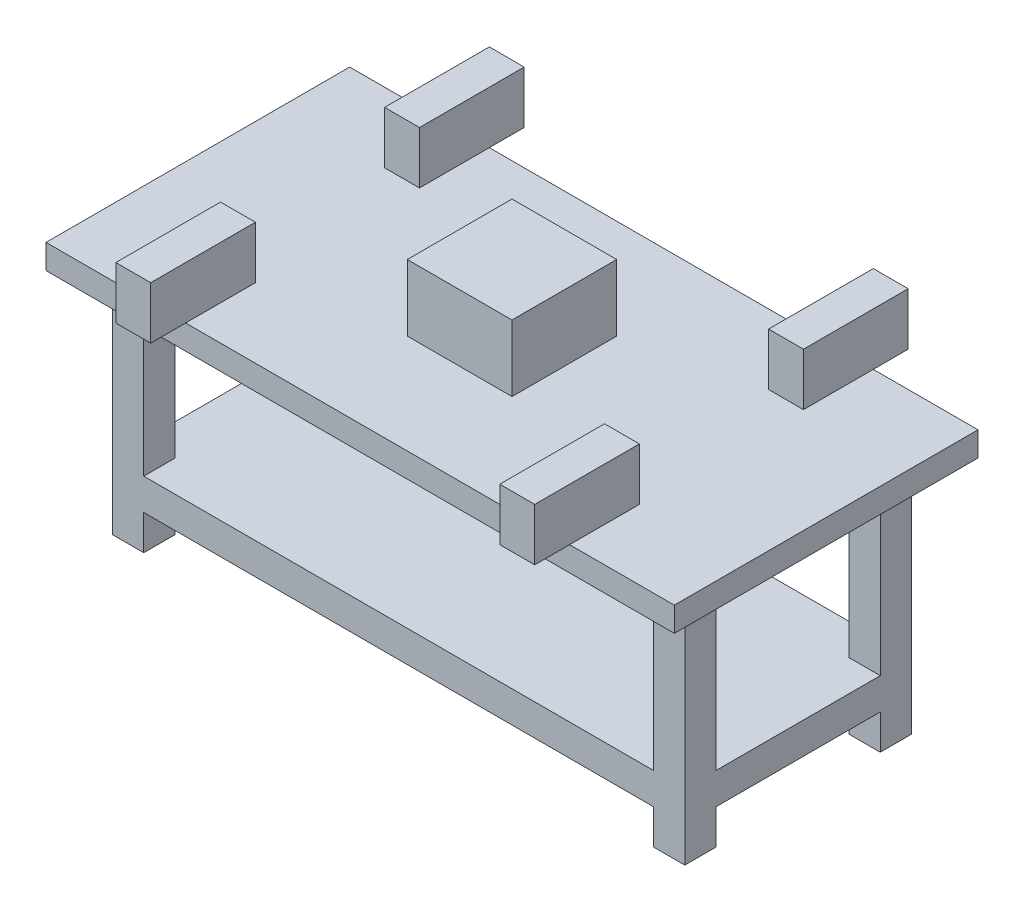
from build123d import *

# Parameters (mm, degrees)
SKETCH_1_W      = 1800
SKETCH_1_H      = 870
EXTRUDE_1_DEPTH = 70
SKETCH_2_W      = 100
SKETCH_2_H      = 300
EXTRUDE_2_DEPTH = 150
SKETCH_3_W      = 300
SKETCH_3_H      = 300
EXTRUDE_3_DEPTH = 190
SKETCH_4_W      = 90
SKETCH_4_H      = 710
SKETCH_4_W_2    = 1460
SKETCH_4_H_2    = 90
EXTRUDE_4_DEPTH = 70
SKETCH_5_W      = 90
SKETCH_5_H      = 90
EXTRUDE_5_DEPTH = 600
EXTRUDE_6_REACH = 2071.251
SKETCH_6_W      = 90
SKETCH_6_H      = 90
EXTRUDE_7_REACH = 2013.641
SKETCH_7_W      = 650
SKETCH_7_H      = 90


with BuildPart() as part:
    # ｽｹｯﾁ1 → ﾎﾞｽ - 押し出し1 (new body)
    with BuildSketch(Plane(origin=(0, 0, 0), x_dir=(1, 0, 0), z_dir=(0, 1, 0))):
        with Locations((900, 435)):
            Rectangle(SKETCH_1_W, SKETCH_1_H)
    extrude(amount=EXTRUDE_1_DEPTH)

    # ｽｹｯﾁ2 → ﾎﾞｽ - 押し出し2 (add)
    with BuildSketch(Plane(origin=(0, 70, 0), x_dir=(1, 0, 0), z_dir=(0, 1, 0))):
        with Locations((350, 50)):
            Rectangle(SKETCH_2_W, SKETCH_2_H)
        with Locations((1450, 50)):
            Rectangle(SKETCH_2_W, SKETCH_2_H)
        with Locations((1450, 820)):
            Rectangle(SKETCH_2_W, SKETCH_2_H)
        with Locations((350, 820)):
            Rectangle(SKETCH_2_W, SKETCH_2_H)
    extrude(amount=EXTRUDE_2_DEPTH)

    # ｽｹｯﾁ3 → ﾎﾞｽ - 押し出し3 (add)
    with BuildSketch(Plane(origin=(0, 70, 0), x_dir=(1, 0, 0), z_dir=(0, 1, 0))):
        with Locations((900, 435)):
            Rectangle(SKETCH_3_W, SKETCH_3_H)
    extrude(amount=EXTRUDE_3_DEPTH)

    # ｽｹｯﾁ4 → ﾎﾞｽ - 押し出し4 (add)
    with BuildSketch(Plane(origin=(0, 0, 0), x_dir=(-1, 0, 0), z_dir=(0, -1, 0))):
        with Locations((-1675, 435)):
            Rectangle(SKETCH_4_W, SKETCH_4_H)
        with Locations((-900, 715)):
            Rectangle(SKETCH_4_W_2, SKETCH_4_H_2)
        with Locations((-900, 155)):
            Rectangle(SKETCH_4_W_2, SKETCH_4_H_2)
        with Locations((-125, 435)):
            Rectangle(SKETCH_4_W, SKETCH_4_H)
    extrude(amount=EXTRUDE_4_DEPTH)

    # ｽｹｯﾁ5 → ﾎﾞｽ - 押し出し5 (add)
    with BuildSketch(Plane(origin=(0, -70, 0), x_dir=(-1, 0, 0), z_dir=(0, -1, 0))):
        with Locations((-1675, 155)):
            Rectangle(SKETCH_5_W, SKETCH_5_H)
        with Locations((-1675, 715)):
            Rectangle(SKETCH_5_W, SKETCH_5_H)
        with Locations((-125, 155)):
            Rectangle(SKETCH_5_W, SKETCH_5_H)
        with Locations((-125, 715)):
            Rectangle(SKETCH_5_W, SKETCH_5_H)
    extrude(amount=EXTRUDE_5_DEPTH)

    # ｽｹｯﾁ6 → ﾎﾞｽ - 押し出し6 (add, up to next)
    with BuildSketch(Plane(origin=(0, 0, -200), x_dir=(-1, 0, 0), z_dir=(0, 0, -1)), mode=Mode.PRIVATE) as extrude_6_sk1:
        with Locations((-1675, -525)):
            Rectangle(SKETCH_6_W, SKETCH_6_H)
    extrude_6_tool1 = extrude(extrude_6_sk1.sketch, amount=EXTRUDE_6_REACH, mode=Mode.PRIVATE) - part.part
    # ｽｹｯﾁ6 → ﾎﾞｽ - 押し出し6 (add, up to next)
    with BuildSketch(Plane(origin=(0, 0, -200), x_dir=(-1, 0, 0), z_dir=(0, 0, -1)), mode=Mode.PRIVATE) as extrude_6_sk2:
        with Locations((-125, -525)):
            Rectangle(SKETCH_6_W, SKETCH_6_H)
    extrude_6_tool2 = extrude(extrude_6_sk2.sketch, amount=EXTRUDE_6_REACH, mode=Mode.PRIVATE) - part.part
    add(extrude_6_tool1.solids().sort_by_distance((1675, -525, -200))[0])
    add(extrude_6_tool2.solids().sort_by_distance((125, -525, -200))[0])

    # ｽｹｯﾁ7 → ﾎﾞｽ - 押し出し7 (add, up to next)
    with BuildSketch(Plane.ZY.offset(-1630), mode=Mode.PRIVATE) as extrude_7_sk1:
        with Locations((-435, -525)):
            Rectangle(SKETCH_7_W, SKETCH_7_H)
    extrude_7_tool1 = extrude(extrude_7_sk1.sketch, amount=EXTRUDE_7_REACH, mode=Mode.PRIVATE) - part.part
    add(extrude_7_tool1.solids().sort_by_distance((1630, -525, -435))[0])


solid = part.part
